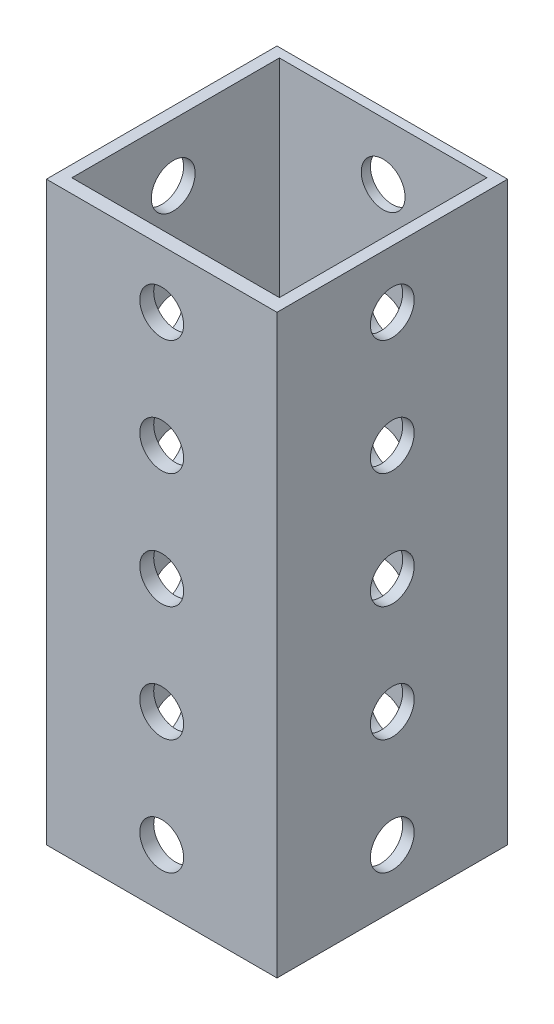
from build123d import *

# Parameters (mm, degrees)
SKETCH2_W           = 25.4
SKETCH2_H           = 25.4
SKETCH2_W_2         = 22.86
SKETCH2_H_2         = 22.86
BOSS_EXTRUDE1_DEPTH = 63.5
SKETCH3_R           = 2.413
CUT_EXTRUDE1_DEPTH  = 70.560764803
SKETCH4_R           = 2.413
CUT_EXTRUDE2_DEPTH  = 70.560764803


with BuildPart() as part:
    # Sketch2 → Boss-Extrude1 (new body)
    with BuildSketch(Plane(origin=(0, 0, 0), x_dir=(1, 0, 0), z_dir=(0, 1, 0))):
        Rectangle(SKETCH2_W, SKETCH2_H)
        with Locations((0, 0.262548077)):
            Rectangle(SKETCH2_W_2, SKETCH2_H_2, mode=Mode.SUBTRACT)
    extrude(amount=BOSS_EXTRUDE1_DEPTH)

    # Sketch3 → Cut-Extrude1 (cut, through all)
    with BuildSketch(Plane(origin=(0, 0, -12.7), x_dir=(-1, 0, 0), z_dir=(0, 0, -1))):
        with Locations((0, 57.15)):
            Circle(SKETCH3_R)
        with Locations((0, 44.45)):
            Circle(SKETCH3_R)
        with Locations((0, 31.75)):
            Circle(SKETCH3_R)
        with Locations((0, 19.05)):
            Circle(SKETCH3_R)
        with Locations((0, 6.35)):
            Circle(SKETCH3_R)
        with Locations((0, -6.35)):
            Circle(SKETCH3_R)
    extrude(amount=-CUT_EXTRUDE1_DEPTH, mode=Mode.SUBTRACT)

    # Sketch4 → Cut-Extrude2 (cut, through all)
    with BuildSketch(Plane(origin=(12.7, 0, 0), x_dir=(0, 0, -1), z_dir=(1, 0, 0))):
        with Locations((0, 57.15)):
            Circle(SKETCH4_R)
        with Locations((0, 44.45)):
            Circle(SKETCH4_R)
        with Locations((0, 31.75)):
            Circle(SKETCH4_R)
        with Locations((0, 19.05)):
            Circle(SKETCH4_R)
        with Locations((0, 6.35)):
            Circle(SKETCH4_R)
        with Locations((0, -6.35)):
            Circle(SKETCH4_R)
    extrude(amount=-CUT_EXTRUDE2_DEPTH, mode=Mode.SUBTRACT)


solid = part.part
